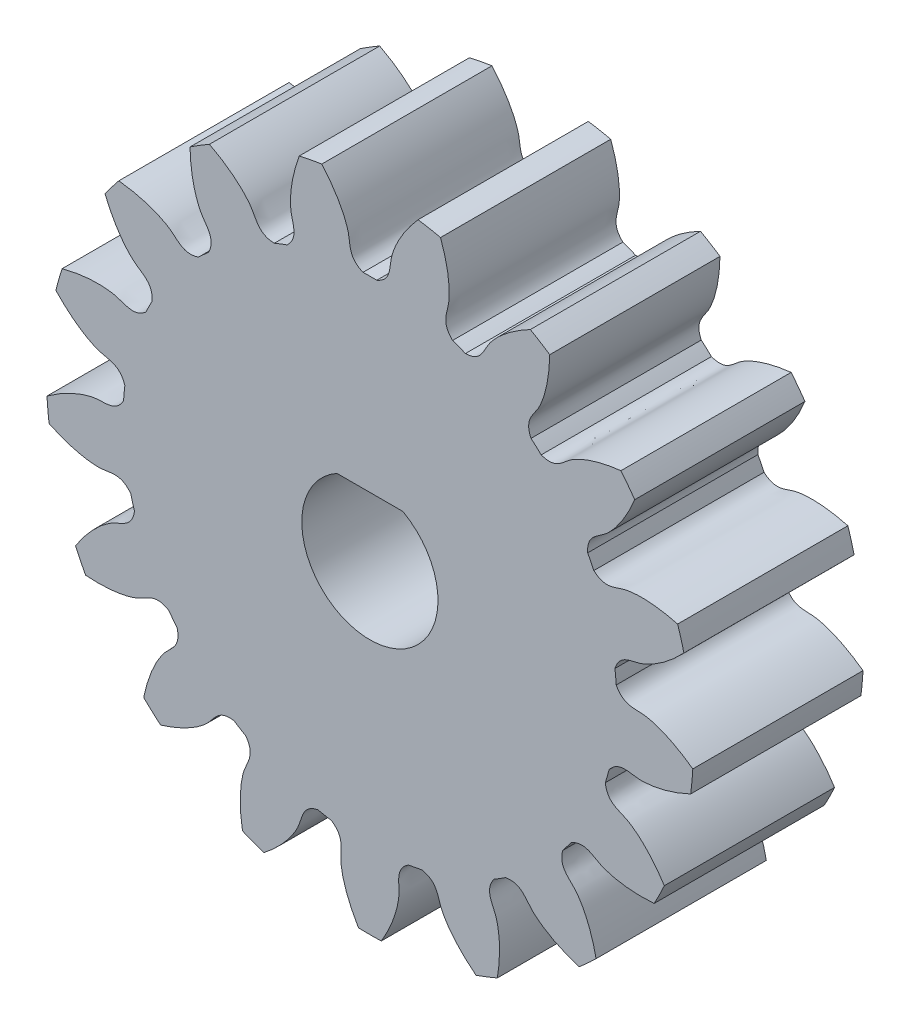
from build123d import *

# Parameters (mm, degrees)
SKETCH_1_R               = 19
EXTRUDE_1_DEPTH          = 10
CUT_EXTRUDE_1_DEPTH      = 29.670542374
PATTERN_CIRCULAR_1_COUNT = 17
CUT_EXTRUDE_2_REACH      = 30.65


with BuildPart() as part:
    # 草图1 → 凸台-拉伸1 (new body)
    with BuildSketch(Plane.XY):
        Circle(SKETCH_1_R)
    extrude(amount=EXTRUDE_1_DEPTH)

    # 草图2 → 切除-拉伸1 (cut, through all)
    with BuildSketch(Plane.XY):
        with BuildLine():
            ThreePointArc((0.403387494, 14.494387829), (0, 14.5), (-0.403387494, 14.494387829))
            add(Edge.make_bspline(
                [(-0.403387494, 14.494387829), (-1.255759481, 14.849644042), (-1.132390756, 15.509626813), (-1.276611209, 16.129648275), (-1.289951469, 16.18230119), (-1.306037005, 16.240838627), (-1.32510118, 16.305170665), (-1.347383555, 16.375198727), (-1.373118159, 16.450817515), (-1.40253689, 16.531914502), (-1.435868224, 16.618370188), (-1.473337358, 16.710058129), (-1.515165928, 16.80684504), (-1.561571855, 16.908590882), (-1.612769151, 17.015148962), (-1.66896775, 17.12636603), (-1.730373323, 17.242082389), (-1.797187111, 17.362132), (-1.869605751, 17.4863426), (-1.947821109, 17.61453582), (-2.032020115, 17.746527309), (-2.1223846, 17.882126855), (-2.219091138, 18.021138524), (-2.32231089, 18.163360791), (-2.432209452, 18.308586678), (-2.548946705, 18.456603899), (-2.67267667, 18.607195006), (-2.803547366, 18.760137539), (-2.941700674, 18.915204179), (-3.087272199, 19.072162909), (-3.24039114, 19.23077717), (-3.401180166, 19.390806026), (-3.569755292, 19.552004336), (-3.746225758, 19.71412292), (-3.930693918, 19.876908731), (-4.123255131, 20.040105038), (-4.323997649, 20.203451599), (-4.533002522, 20.366684847), (-4.750343497, 20.529538073), (-4.976086928, 20.691741613), (-5.210291694, 20.853023038), (-5.453009069, 21.013107349), (-5.79164327, 21.226861067), (-6.053153804, 21.381051942), (-6.231291666, 21.481438237)],
                knots=[0, 0, 0, 0, 0.193882922, 0.199023975, 0.204850501, 0.211362501, 0.218559975, 0.226442923, 0.235011345, 0.24426524, 0.254204608, 0.264829451, 0.276139767, 0.288135557, 0.300816821, 0.314183558, 0.328235769, 0.342973453, 0.358396612, 0.374505244, 0.39129935, 0.408778929, 0.426943982, 0.445794509, 0.46533051, 0.485551984, 0.506458932, 0.528051354, 0.550329249, 0.573292619, 0.596941461, 0.621275778, 0.646295568, 0.672000832, 0.69839157, 0.725467781, 0.753229466, 0.781676625, 0.810809257, 0.840627364, 0.871130943, 0.902319997, 0.934194524, 1, 1, 1, 1], degree=3))
            ThreePointArc((-6.231291666, 21.481438237), (0, 22.366966369), (6.231291666, 21.481438237))
            add(Edge.make_bspline(
                [(0.403387494, 14.494387829), (1.255759481, 14.849644042), (1.132390756, 15.509626813), (1.276611209, 16.129648275), (1.289951469, 16.18230119), (1.306037005, 16.240838627), (1.32510118, 16.305170665), (1.347383555, 16.375198727), (1.373118159, 16.450817515), (1.40253689, 16.531914502), (1.435868224, 16.618370188), (1.473337358, 16.710058129), (1.515165928, 16.80684504), (1.561571855, 16.908590882), (1.612769151, 17.015148962), (1.66896775, 17.12636603), (1.730373323, 17.242082389), (1.797187111, 17.362132), (1.869605751, 17.4863426), (1.947821109, 17.61453582), (2.032020115, 17.746527309), (2.1223846, 17.882126855), (2.219091138, 18.021138524), (2.32231089, 18.163360791), (2.432209452, 18.308586678), (2.548946705, 18.456603899), (2.67267667, 18.607195006), (2.803547366, 18.760137539), (2.941700674, 18.915204179), (3.087272199, 19.072162909), (3.24039114, 19.23077717), (3.401180166, 19.390806026), (3.569755292, 19.552004336), (3.746225758, 19.71412292), (3.930693918, 19.876908731), (4.123255131, 20.040105038), (4.323997649, 20.203451599), (4.533002522, 20.366684847), (4.750343497, 20.529538073), (4.976086928, 20.691741613), (5.210291694, 20.853023038), (5.453009069, 21.013107349), (5.79164327, 21.226861067), (6.053153804, 21.381051942), (6.231291666, 21.481438237)],
                knots=[0, 0, 0, 0, 0.193882922, 0.199023975, 0.204850501, 0.211362501, 0.218559975, 0.226442923, 0.235011345, 0.24426524, 0.254204608, 0.264829451, 0.276139767, 0.288135557, 0.300816821, 0.314183558, 0.328235769, 0.342973453, 0.358396612, 0.374505244, 0.39129935, 0.408778929, 0.426943982, 0.445794509, 0.46533051, 0.485551984, 0.506458932, 0.528051354, 0.550329249, 0.573292619, 0.596941461, 0.621275778, 0.646295568, 0.672000832, 0.69839157, 0.725467781, 0.753229466, 0.781676625, 0.810809257, 0.840627364, 0.871130943, 0.902319997, 0.934194524, 1, 1, 1, 1], degree=3))
        make_face()
    cut_extrude_1 = extrude(amount=CUT_EXTRUDE_1_DEPTH, mode=Mode.SUBTRACT)

    # 阵列(圆周)1: 切除-拉伸1 ×17 about axis
    pattern_circular_1_axis = Axis((0, 0, -1.5), (0, 0, 1))
    for i in range(1, PATTERN_CIRCULAR_1_COUNT):
        add(cut_extrude_1.rotate(pattern_circular_1_axis, i * 360 / PATTERN_CIRCULAR_1_COUNT), mode=Mode.SUBTRACT)

    # 草图4 → 切除-拉伸2 (cut, up to next)
    with BuildSketch(Plane.XY.offset(10), mode=Mode.PRIVATE) as cut_extrude_2_sk1:
        with BuildLine():
            Line((-1.936491673, 3.5), (1.936491673, 3.5))
            ThreePointArc((1.936491673, 3.5), (0, -4), (-1.936491673, 3.5))
        make_face()
    cut_extrude_2_tool1 = extrude(cut_extrude_2_sk1.sketch, amount=-CUT_EXTRUDE_2_REACH, mode=Mode.PRIVATE) & part.part
    add(cut_extrude_2_tool1.solids().sort_by_distance((0, -0.098886, 10))[0], mode=Mode.SUBTRACT)


solid = part.part
